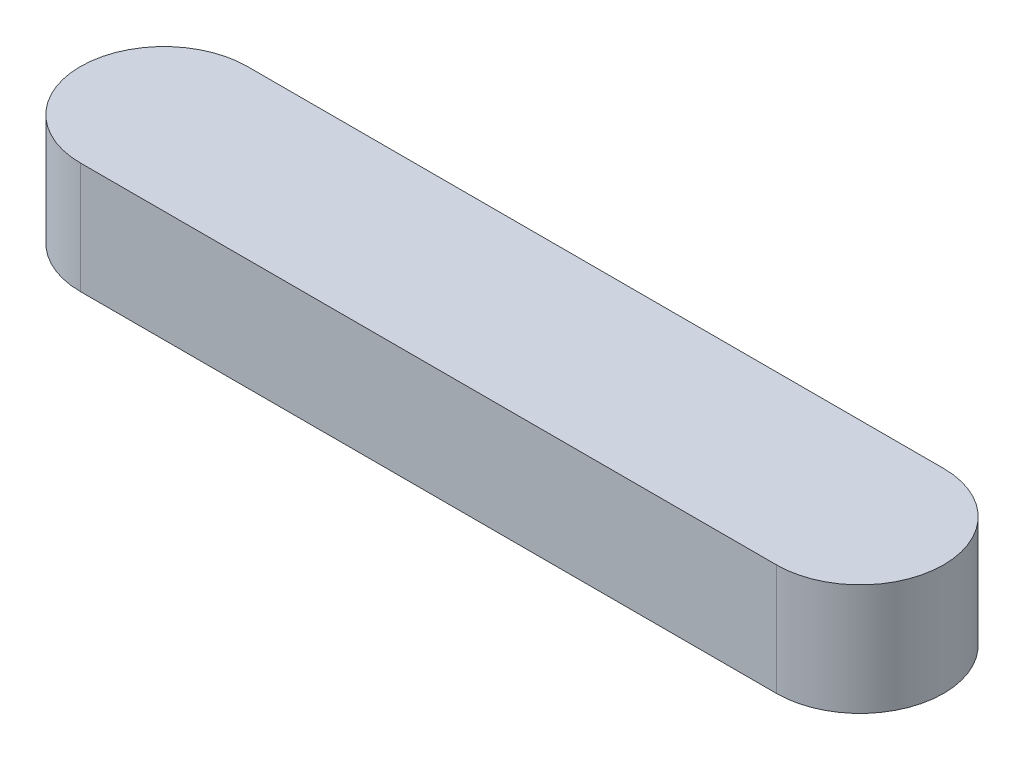
from build123d import *

# Parameters (mm, degrees)
BOSS_EXTRUDE1_DEPTH = 4


with BuildPart() as part:
    # Sketch1 → Boss-Extrude1 (new body)
    with BuildSketch(Plane(origin=(0, 0, 0), x_dir=(1, 0, 0), z_dir=(0, 1, 0))):
        with BuildLine():
            Line((0, 3), (25, 3))
            ThreePointArc((25, 3), (28, 0), (25, -3))
            Line((25, -3), (0, -3))
            ThreePointArc((0, -3), (-3, 0), (0, 3))
        make_face()
    extrude(amount=BOSS_EXTRUDE1_DEPTH)


solid = part.part
